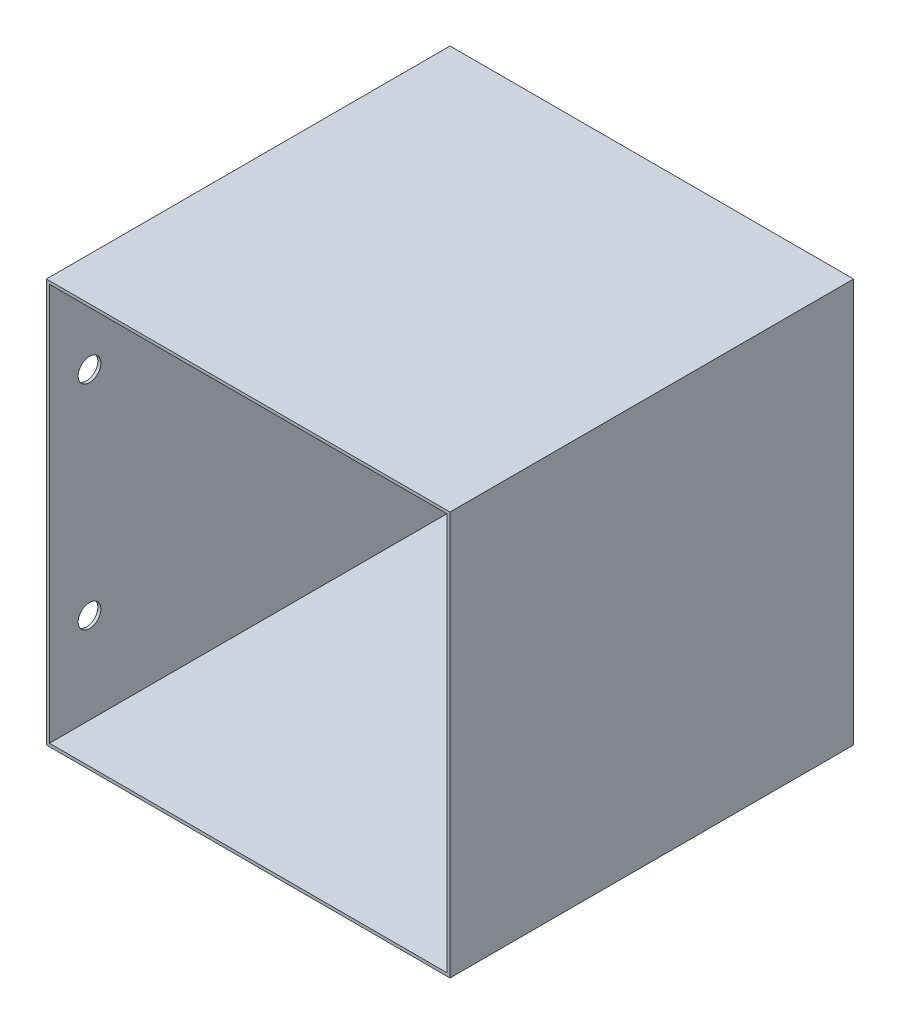
from build123d import *

# Parameters (mm, degrees)
CROQUIS1_W                       = 80
CROQUIS1_H                       = 80
SALIENTE_EXTRUIR1_DEPTH          = 80
VACIADO1_T                       = -0.6
TALADRO_DE_MARGEN_PARA_M41_D     = 4.5
TALADRO_DE_MARGEN_PARA_M41_DEPTH = 5


with BuildPart() as part:
    # Croquis1 → Saliente-Extruir1 (new body)
    with BuildSketch(Plane.XY):
        with Locations((40, 40)):
            Rectangle(CROQUIS1_W, CROQUIS1_H)
    extrude(amount=SALIENTE_EXTRUIR1_DEPTH)

    # Vaciado1
    vaciado1_openings = [part.faces().sort_by_distance(p)[0] for p in [
        (40, 40, 80),
        (40, 40, 0),
    ]]
    offset(amount=VACIADO1_T, openings=vaciado1_openings, kind=Kind.INTERSECTION)

    # Taladro de margen para M41
    with Locations(Plane(origin=(0, -79.637122061, 0), x_dir=(0, 1, 0), z_dir=(-1, 0, 0))):
        with Locations((98.1889532, -72.0625), (140.429406251, -72.0625)):
            Hole(TALADRO_DE_MARGEN_PARA_M41_D / 2, depth=TALADRO_DE_MARGEN_PARA_M41_DEPTH)


solid = part.part
